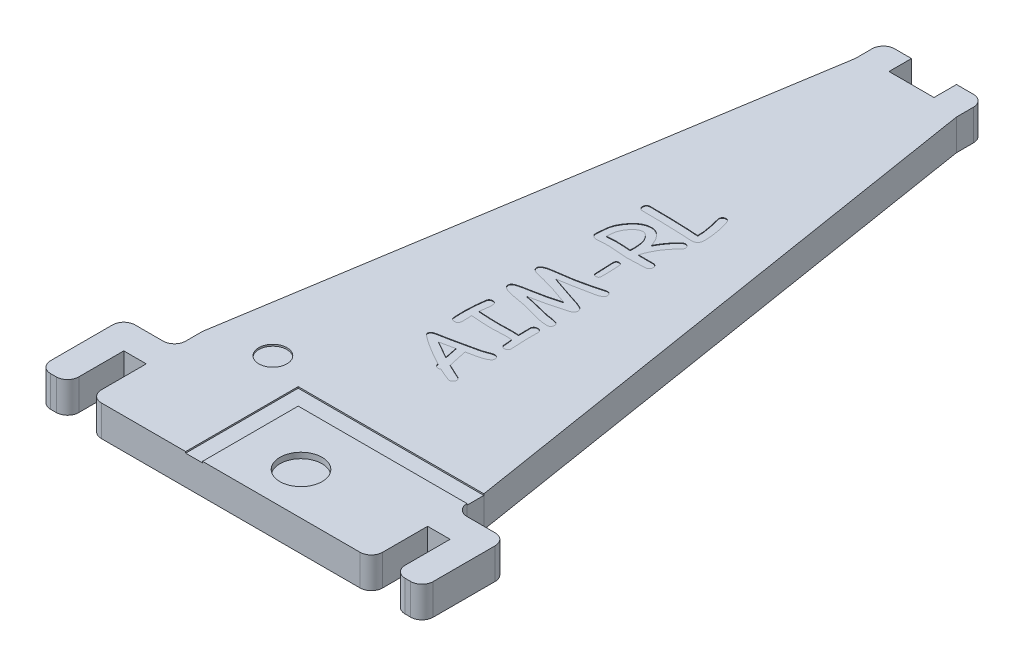
from build123d import *

# Parameters (mm, degrees)
BOSS_EXTRUDE1_DEPTH = 0.55
FILLET1_R           = 0.2
CUT_EXTRUDE1_DEPTH  = 0.025
SKETCH5_R           = 0.25
CUT_EXTRUDE3_DEPTH  = 0.03
SKETCH6_R           = 0.375
CUT_EXTRUDE4_DEPTH  = 0.1
CUT_EXTRUDE5_DEPTH  = 0.01


with BuildPart() as part:
    # Sketch1 → Boss-Extrude1 (new body)
    with BuildSketch(Plane(origin=(0, 0, 0), x_dir=(1, 0, 0), z_dir=(0, 1, 0))):
        Polygon((0, 0), (0, 1.5), (0.9, 1.5), (0.9, 2), (2.5, 12), (2.5, 12.5), (3, 12.5), (3, 12.1), (3.8, 12.1), (3.8, 12.5), (4.3, 12.5), (4.3, 12), (5.9, 2), (5.9, 1.5), (6.8, 1.5), (6.8, 0), (6.3, 0), (6.3, 1), (5.9, 1), (5.9, 0), (0.9, 0), (0.9, 1), (0.5, 1), (0.5, 0), align=None)
    extrude(amount=BOSS_EXTRUDE1_DEPTH)

    # Fillet1
    fillet1_edges = [part.edges().sort_by_distance(p)[0] for p in [
        (0, 0.275, 0),
        (0, 0.275, -1.5),
        (0.9, 0.275, -1.5),
        (2.5, 0.275, -12.5),
        (4.3, 0.275, -12.5),
        (5.9, 0.275, -1.5),
        (6.8, 0.275, -1.5),
        (6.8, 0.275, 0),
        (6.3, 0.275, 0),
        (5.9, 0.275, 0),
        (0.9, 0.275, 0),
        (0.5, 0.275, 0),
    ]]
    fillet(fillet1_edges, radius=FILLET1_R)

    # Sketch3 → Cut-Extrude1 (cut)
    with BuildSketch(Plane(origin=(0, 0.55, 0), x_dir=(1, 0, 0), z_dir=(0, 1, 0))):
        Polygon((5.9, 2), (2.6, 2), (2.6, 0), (2.9, 0), (2.9, 1.7), (5.9, 1.7), align=None)
    extrude(amount=-CUT_EXTRUDE1_DEPTH, mode=Mode.SUBTRACT)

    # Sketch5 → Cut-Extrude3 (cut)
    with BuildSketch(Plane(origin=(0, 0.55, 0), x_dir=(1, 0, 0), z_dir=(0, 1, 0))):
        with Locations(Location((1.9, 2.25, 0), (0, 0, 270))):
            Circle(SKETCH5_R)
    extrude(amount=-CUT_EXTRUDE3_DEPTH, mode=Mode.SUBTRACT)

    # Sketch6 → Cut-Extrude4 (cut)
    with BuildSketch(Plane(origin=(0, 0.55, 0), x_dir=(1, 0, 0), z_dir=(0, 1, 0))):
        with Locations(Location((3.9, 0.75, 0), (0, 0, 270))):
            Circle(SKETCH6_R)
    extrude(amount=-CUT_EXTRUDE4_DEPTH, mode=Mode.SUBTRACT)

    # Sketch7 → Cut-Extrude5 (cut)
    # profile 1 of 6: a face of its own
    with BuildSketch(Plane(origin=(0, 0.55, 0), x_dir=(1, 0, 0), z_dir=(0, 1, 0))):
        with BuildLine():
            add(Edge.make_bspline(
                [(3.875, 8.347239045), (3.877950804, 8.340633179), (3.884153746, 8.326746858), (3.89215336, 8.304064521), (3.900475552, 8.278933799), (3.908119493, 8.250981213), (3.915777784, 8.220449153), (3.923122581, 8.187284146), (3.930389371, 8.151477625), (3.934817651, 8.126675965), (3.937109375, 8.113840608)],
                knots=[0, 0, 0, 0, 0.716894363, 1.506997736, 2.382516578, 3.340795718, 4.37853117, 5.502706371, 6.707600307, 8, 8, 8, 8], degree=3))
            add(Edge.make_bspline(
                [(3.937109375, 8.113840608), (3.939072597, 8.101863318), (3.942900485, 8.078510014), (3.948323535, 8.044367413), (3.952465721, 8.011903096), (3.956363548, 7.981206367), (3.959034786, 7.952081602), (3.960998069, 7.924667845), (3.962254478, 7.898943502), (3.962419922, 7.882396579), (3.9625, 7.874387483)],
                knots=[0, 0, 0, 0, 1.208364037, 2.356066661, 3.441421887, 4.466459362, 5.43647296, 6.352675533, 7.202656582, 8, 8, 8, 8], degree=3))
            add(Edge.make_bspline(
                [(3.9625, 7.874387483), (3.962361623, 7.864077904), (3.962103809, 7.844869779), (3.958097328, 7.818526341), (3.952518917, 7.796297462), (3.94544188, 7.784366246), (3.9421875, 7.77887967)],
                knots=[0, 0, 0, 0, 1.248242448, 2.325642727, 3.230045851, 4, 4, 4, 4], degree=3))
            add(Edge.make_bspline(
                [(3.9421875, 7.77887967), (3.939750342, 7.77572512), (3.934824304, 7.769349072), (3.925430329, 7.761414052), (3.914857574, 7.754451279), (3.902707612, 7.749121729), (3.88939477, 7.744405148), (3.87442099, 7.741799675), (3.858135503, 7.739637011), (3.84675386, 7.739498667), (3.840820312, 7.739426545)],
                knots=[0, 0, 0, 0, 0.844122761, 1.706159937, 2.595573628, 3.52325448, 4.515413457, 5.586101637, 6.741571747, 8, 8, 8, 8], degree=3))
            Line((3.840820312, 7.739426545), (3.623242187, 7.750364045))
            add(Edge.make_bspline(
                [(3.623242187, 7.750364045), (3.597787675, 7.751498935), (3.54623404, 7.753797454), (3.467849956, 7.756765239), (3.387440208, 7.759032552), (3.304952675, 7.7610065), (3.220445901, 7.762539298), (3.133857463, 7.763773539), (3.045248085, 7.764302087), (2.985481809, 7.764384759), (2.955273437, 7.764426545)],
                knots=[0, 0, 0, 0, 0.915198011, 1.853572545, 2.817422793, 3.804526, 4.81724794, 5.853276595, 6.914956373, 8, 8, 8, 8], degree=3))
            add(Edge.make_bspline(
                [(2.955273437, 7.764426545), (2.950688078, 7.764619823), (2.941745523, 7.764996763), (2.928899513, 7.768913198), (2.917233084, 7.775258063), (2.906950691, 7.783874557), (2.898272249, 7.794192242), (2.89199115, 7.806034027), (2.888068854, 7.819065032), (2.887692805, 7.828135426), (2.8875, 7.83278592)],
                knots=[0, 0, 0, 0, 1.024004689, 1.997055877, 2.975332707, 3.979329853, 4.983326999, 5.97444025, 6.961472618, 8, 8, 8, 8], degree=3))
            add(Edge.make_bspline(
                [(2.8875, 7.83278592), (2.887685707, 7.83756773), (2.888045545, 7.84683328), (2.891983046, 7.860022303), (2.898101722, 7.872033734), (2.90669857, 7.8824648), (2.917042446, 7.891090171), (2.928702977, 7.897441163), (2.941550535, 7.901355991), (2.950492876, 7.901733153), (2.955078125, 7.901926545)],
                knots=[0, 0, 0, 0, 1.061271793, 2.056390056, 3.03491476, 4.044172653, 5.042240045, 6.014739028, 6.982043233, 8, 8, 8, 8], degree=3))
            add(Edge.make_bspline(
                [(2.955078125, 7.901926545), (2.985612197, 7.901907971), (3.045965258, 7.901871258), (3.135418867, 7.901008487), (3.222789926, 7.899866912), (3.3080119, 7.898288066), (3.391220441, 7.896411525), (3.472272387, 7.893794765), (3.551317827, 7.890976125), (3.603257338, 7.888500585), (3.62890625, 7.887278108)],
                knots=[0, 0, 0, 0, 1.087178817, 2.148896846, 3.185168921, 4.198336654, 5.183790453, 6.148579661, 7.085726527, 8, 8, 8, 8], degree=3))
            Line((3.62890625, 7.887278108), (3.728710937, 7.880246858))
            add(Edge.make_bspline(
                [(3.728710937, 7.880246858), (3.737496571, 7.879538241), (3.754533819, 7.878164079), (3.77941799, 7.877108122), (3.80273295, 7.876302024), (3.817773356, 7.87672386), (3.825, 7.876926545)],
                knots=[0, 0, 0, 0, 1.0970738, 2.12746397, 3.100280121, 4, 4, 4, 4], degree=3))
            add(Edge.make_bspline(
                [(3.825, 7.876926545), (3.824870291, 7.891513656), (3.824601938, 7.921692829), (3.821586055, 7.968370435), (3.816005834, 8.017809103), (3.808130963, 8.069981523), (3.797973356, 8.124975759), (3.785098234, 8.182678344), (3.770388099, 8.243378122), (3.758853379, 8.284512694), (3.752929688, 8.305637483)],
                knots=[0, 0, 0, 0, 0.802635763, 1.660567672, 2.572505645, 3.539741198, 4.563550896, 5.649275195, 6.792777905, 8, 8, 8, 8], degree=3))
            add(Edge.make_bspline(
                [(3.752929688, 8.305637483), (3.752100935, 8.309202592), (3.750516313, 8.316019288), (3.750166745, 8.323007302), (3.75, 8.326340608)],
                knots=[0, 0, 0, 0, 1.045993323, 2, 2, 2, 2], degree=3))
            add(Edge.make_bspline(
                [(3.75, 8.326340608), (3.750261515, 8.330863891), (3.750772267, 8.339698117), (3.754844711, 8.352330817), (3.761596937, 8.363827619), (3.76800099, 8.370030714), (3.771289062, 8.373215608)],
                knots=[0, 0, 0, 0, 1.020445198, 1.992986761, 2.969526912, 4, 4, 4, 4], degree=3))
            add(Edge.make_bspline(
                [(3.771289062, 8.373215608), (3.774598459, 8.37568254), (3.781091162, 8.380522413), (3.792092898, 8.385623556), (3.803776077, 8.388951063), (3.811890804, 8.389266304), (3.816015625, 8.389426545)],
                knots=[0, 0, 0, 0, 1.018403838, 1.998005638, 2.982360251, 4, 4, 4, 4], degree=3))
            add(Edge.make_bspline(
                [(3.816015625, 8.389426545), (3.819281852, 8.38933851), (3.825617672, 8.38916774), (3.83478501, 8.38712842), (3.843303113, 8.383788133), (3.851115195, 8.3790521), (3.858301755, 8.373125524), (3.8645621, 8.365711516), (3.870282433, 8.35706072), (3.873384702, 8.350601993), (3.875, 8.347239045)],
                knots=[0, 0, 0, 0, 1.012499008, 1.964043618, 2.898691715, 3.84160927, 4.788850173, 5.777666492, 6.842869086, 8, 8, 8, 8], degree=3))
        make_face()
    # profile 2 of 6: a face of its own
    with BuildSketch(Plane(origin=(0, 0.55, 0), x_dir=(1, 0, 0), z_dir=(0, 1, 0))):
        with BuildLine():
            add(Edge.make_bspline(
                [(3.9125, 7.57341092), (3.912212726, 7.569410495), (3.911629545, 7.561289423), (3.907544211, 7.549394913), (3.900660896, 7.53797405), (3.894469705, 7.531248058), (3.891210937, 7.527707795)],
                knots=[0, 0, 0, 0, 0.92759402, 1.883064472, 2.885739552, 4, 4, 4, 4], degree=3))
            add(Edge.make_bspline(
                [(3.891210937, 7.527707795), (3.873557926, 7.509801852), (3.838693519, 7.474437909), (3.790580491, 7.418680476), (3.747107044, 7.361268757), (3.707969091, 7.302471225), (3.673229273, 7.242163438), (3.643132805, 7.180285398), (3.617258219, 7.116980534), (3.603791203, 7.073584103), (3.597070312, 7.051926545)],
                knots=[0, 0, 0, 0, 1.06668371, 2.106682745, 3.122149944, 4.120443899, 5.101746213, 6.072804342, 7.03820772, 8, 8, 8, 8], degree=3))
            Line((3.597070312, 7.051926545), (3.7265625, 7.051926545))
            Line((3.7265625, 7.051926545), (3.856835937, 7.051926545))
            add(Edge.make_bspline(
                [(3.856835937, 7.051926545), (3.861482868, 7.051723036), (3.870608949, 7.051323367), (3.883692313, 7.047528469), (3.895463882, 7.041089181), (3.90573045, 7.032472626), (3.914457905, 7.022213397), (3.920507056, 7.010209641), (3.924438496, 6.997093717), (3.924809698, 6.987893272), (3.925, 6.983176545)],
                knots=[0, 0, 0, 0, 1.030253241, 2.023308341, 2.993791058, 3.989789173, 4.985787287, 5.962283232, 6.955338332, 8, 8, 8, 8], degree=3))
            add(Edge.make_bspline(
                [(3.925, 6.983176545), (3.924808832, 6.978460493), (3.924435939, 6.969261364), (3.920516628, 6.956135992), (3.914399372, 6.944122344), (3.905797256, 6.933699454), (3.895540752, 6.925101039), (3.88379284, 6.918818652), (3.870806704, 6.915024714), (3.861679005, 6.914628364), (3.85703125, 6.914426545)],
                knots=[0, 0, 0, 0, 1.04576213, 2.039863328, 3.017387927, 4.025614305, 5.022661618, 5.974560277, 6.968661475, 8, 8, 8, 8], degree=3))
            add(Edge.make_bspline(
                [(3.85703125, 6.914426545), (3.85240841, 6.914458477), (3.842640197, 6.91452595), (3.82721529, 6.913956745), (3.810148929, 6.913745298), (3.791539983, 6.912771897), (3.771279025, 6.912172093), (3.749419861, 6.910796231), (3.725898632, 6.90983995), (3.701376836, 6.90807334), (3.676882038, 6.906918806), (3.653461815, 6.905350741), (3.631635715, 6.904574657), (3.61140251, 6.903384063), (3.592770473, 6.90299715), (3.57572169, 6.902216859), (3.560285739, 6.902156637), (3.550520634, 6.902000466), (3.545898438, 6.901926545)],
                knots=[0, 0, 0, 0, 0.712445335, 1.505420197, 2.37864724, 3.34278945, 4.377115989, 5.502584942, 6.718244155, 8.005158812, 9.291486525, 10.497666444, 11.622643233, 12.657407746, 13.621184365, 14.49469963, 15.287484003, 16, 16, 16, 16], degree=3))
            add(Edge.make_bspline(
                [(3.545898438, 6.901926545), (3.54049435, 6.901968343), (3.529097441, 6.902056492), (3.511126193, 6.902686176), (3.491333227, 6.903673803), (3.469652778, 6.905056567), (3.446083614, 6.906812678), (3.420628874, 6.908985068), (3.393347798, 6.911508141), (3.364843937, 6.914428574), (3.336403464, 6.917330502), (3.309190037, 6.919881108), (3.283863422, 6.922029276), (3.260425448, 6.923796228), (3.238875514, 6.925186235), (3.219212123, 6.926160844), (3.201371387, 6.9267971), (3.190104624, 6.926884927), (3.184765625, 6.926926545)],
                knots=[0, 0, 0, 0, 0.71629614, 1.510627306, 2.383268869, 3.343040369, 4.390087922, 5.51592497, 6.729244953, 8.021531754, 9.313818555, 10.51854632, 11.644383367, 12.682825442, 13.633984758, 14.506626321, 15.292332674, 16, 16, 16, 16], degree=3))
            add(Edge.make_bspline(
                [(3.184765625, 6.926926545), (3.178449215, 6.9268367), (3.164505653, 6.926638367), (3.141585627, 6.9253406), (3.114629159, 6.923390228), (3.084960938, 6.920676545), (3.055292716, 6.917962862), (3.028336248, 6.91601249), (3.005416222, 6.914714723), (2.99147266, 6.91451639), (2.98515625, 6.914426545)],
                knots=[0, 0, 0, 0, 0.757749544, 1.672742668, 2.753375099, 4, 5.246624901, 6.327257332, 7.242250456, 8, 8, 8, 8], degree=3))
            add(Edge.make_bspline(
                [(2.98515625, 6.914426545), (2.979077981, 6.91468889), (2.967181734, 6.915202346), (2.94990286, 6.919268552), (2.93361093, 6.925821828), (2.923984167, 6.932403933), (2.919140625, 6.935715608)],
                knots=[0, 0, 0, 0, 1.032840748, 2.021452059, 3.004527328, 4, 4, 4, 4], degree=3))
            add(Edge.make_bspline(
                [(2.919140625, 6.935715608), (2.913846186, 6.940075689), (2.903531038, 6.948570431), (2.892969508, 6.965625011), (2.88716155, 6.985012527), (2.88738395, 6.998565452), (2.8875, 7.005637483)],
                knots=[0, 0, 0, 0, 1.01891203, 1.985145153, 2.948631896, 4, 4, 4, 4], degree=3))
            Line((2.8875, 7.005637483), (2.9, 7.165989045))
            add(Edge.make_bspline(
                [(2.9, 7.165989045), (2.902106421, 7.180616322), (2.906190011, 7.208973324), (2.91598702, 7.249355216), (2.92828139, 7.286369801), (2.939215137, 7.308927488), (2.94453125, 7.319895295)],
                knots=[0, 0, 0, 0, 1.100642549, 2.133747954, 3.092606825, 4, 4, 4, 4], degree=3))
            add(Edge.make_bspline(
                [(2.94453125, 7.319895295), (2.950420115, 7.33082482), (2.961950305, 7.35222444), (2.980615467, 7.382737328), (2.999685962, 7.411230498), (3.019220972, 7.437643052), (3.039141747, 7.461977191), (3.059654304, 7.484129504), (3.080824654, 7.504048076), (3.102264068, 7.522095371), (3.124218657, 7.53802515), (3.146731653, 7.55178991), (3.169864072, 7.563247127), (3.193328519, 7.573033689), (3.217471549, 7.580148998), (3.242011426, 7.585439875), (3.267020138, 7.588969964), (3.283907477, 7.589273971), (3.292382813, 7.589426545)],
                knots=[0, 0, 0, 0, 1.285088098, 2.516156837, 3.70133193, 4.833679489, 5.915871266, 6.955543635, 7.956797627, 8.923330369, 9.854944987, 10.762351267, 11.651551949, 12.525187581, 13.390909519, 14.252845023, 15.123146355, 16, 16, 16, 16], degree=3))
            add(Edge.make_bspline(
                [(3.292382813, 7.589426545), (3.300670655, 7.589185558), (3.317100333, 7.58870783), (3.34136602, 7.584199611), (3.364929806, 7.576998304), (3.38767511, 7.566684138), (3.40973672, 7.553732415), (3.430889823, 7.537671441), (3.451533296, 7.518937069), (3.464071429, 7.504599275), (3.470507812, 7.497239045)],
                knots=[0, 0, 0, 0, 0.957970178, 1.899063634, 2.844846954, 3.802284053, 4.781397299, 5.798168747, 6.869701761, 8, 8, 8, 8], degree=3))
            add(Edge.make_bspline(
                [(3.470507812, 7.497239045), (3.475594692, 7.490914832), (3.485867695, 7.478143023), (3.500019373, 7.457817309), (3.513450327, 7.436442888), (3.525620892, 7.413798609), (3.537093686, 7.390063423), (3.547263869, 7.365059886), (3.557003381, 7.339074623), (3.562465013, 7.321164339), (3.565234375, 7.312082795)],
                knots=[0, 0, 0, 0, 0.929713851, 1.877566122, 2.835927701, 3.820636964, 4.821600353, 5.855058901, 6.912391442, 8, 8, 8, 8], degree=3))
            add(Edge.make_bspline(
                [(3.565234375, 7.312082795), (3.574435315, 7.328875928), (3.592392337, 7.361650261), (3.620557502, 7.408694511), (3.64925649, 7.452347803), (3.678083739, 7.492991262), (3.707609676, 7.530050397), (3.737289848, 7.563977903), (3.76734425, 7.594664672), (3.788360096, 7.61305459), (3.798632812, 7.622043733)],
                knots=[0, 0, 0, 0, 1.177489967, 2.298049355, 3.370731458, 4.389520182, 5.361182849, 6.283175119, 7.160802, 8, 8, 8, 8], degree=3))
            add(Edge.make_bspline(
                [(3.798632812, 7.622043733), (3.802133917, 7.624705121), (3.80893267, 7.62987324), (3.820170381, 7.635396505), (3.831784836, 7.63866397), (3.839628521, 7.639172167), (3.843554688, 7.639426545)],
                knots=[0, 0, 0, 0, 1.072795615, 2.083249237, 3.040567974, 4, 4, 4, 4], degree=3))
            add(Edge.make_bspline(
                [(3.843554688, 7.639426545), (3.848071078, 7.639218634), (3.857003412, 7.638807435), (3.869889351, 7.635000101), (3.881637988, 7.628484074), (3.892269843, 7.620015259), (3.90113582, 7.609813638), (3.907818055, 7.598543462), (3.911662081, 7.586217091), (3.912217171, 7.577733475), (3.9125, 7.57341092)],
                knots=[0, 0, 0, 0, 1.024492477, 2.02620001, 3.019021827, 4.06087982, 5.098950756, 6.073196883, 7.018259131, 8, 8, 8, 8], degree=3))
        make_face()
        with BuildLine():
            Line((3.033007812, 7.148996858), (3.025, 7.051926545))
            Line((3.025, 7.051926545), (3.105078125, 7.05934842))
            add(Edge.make_bspline(
                [(3.105078125, 7.05934842), (3.112890557, 7.06005967), (3.127729093, 7.061410582), (3.148862699, 7.063409967), (3.167769998, 7.064050644), (3.179622453, 7.064306901), (3.18515625, 7.064426545)],
                knots=[0, 0, 0, 0, 1.172826967, 2.227607707, 3.172487062, 4, 4, 4, 4], degree=3))
            add(Edge.make_bspline(
                [(3.18515625, 7.064426545), (3.194532295, 7.06441668), (3.214331001, 7.06439585), (3.245641045, 7.063193494), (3.280225816, 7.06199519), (3.304364726, 7.060513921), (3.316992187, 7.059739045)],
                knots=[0, 0, 0, 0, 0.852682441, 1.800547017, 2.849429868, 4, 4, 4, 4], degree=3))
            Line((3.316992187, 7.059739045), (3.448632812, 7.051926545))
            add(Edge.make_bspline(
                [(3.448632812, 7.051926545), (3.448695722, 7.055767703), (3.448847144, 7.065013318), (3.4491489, 7.079730052), (3.449847089, 7.094565231), (3.44995473, 7.104009348), (3.45, 7.107981233)],
                knots=[0, 0, 0, 0, 0.822147572, 1.978897641, 3.149990892, 4, 4, 4, 4], degree=3))
            add(Edge.make_bspline(
                [(3.45, 7.107981233), (3.449821962, 7.121133968), (3.449478025, 7.146542767), (3.447637819, 7.183441328), (3.444086381, 7.217780108), (3.439392023, 7.249646488), (3.432847014, 7.278827652), (3.425326913, 7.305580513), (3.416349851, 7.329857582), (3.408735204, 7.34463439), (3.405078125, 7.351731233)],
                knots=[0, 0, 0, 0, 1.261397645, 2.436800874, 3.541356735, 4.570917686, 5.52371442, 6.407028209, 7.234945022, 8, 8, 8, 8], degree=3))
            add(Edge.make_bspline(
                [(3.405078125, 7.351731233), (3.40146306, 7.357655078), (3.394162738, 7.369617792), (3.381361842, 7.386498793), (3.367274701, 7.402953765), (3.35673204, 7.413016733), (3.351367188, 7.418137483)],
                knots=[0, 0, 0, 0, 0.970995645, 1.960844865, 2.962333636, 4, 4, 4, 4], degree=3))
            add(Edge.make_bspline(
                [(3.351367188, 7.418137483), (3.345565731, 7.423248327), (3.334877955, 7.432663816), (3.318379254, 7.443381579), (3.303129009, 7.45035759), (3.293088937, 7.451432661), (3.288476563, 7.451926545)],
                knots=[0, 0, 0, 0, 1.272584969, 2.34442902, 3.239436328, 4, 4, 4, 4], degree=3))
            add(Edge.make_bspline(
                [(3.288476563, 7.451926545), (3.280833032, 7.451644278), (3.265582741, 7.451081103), (3.242951839, 7.445910829), (3.220864488, 7.437568392), (3.198888058, 7.426394967), (3.177651969, 7.41155936), (3.156823161, 7.393531575), (3.136287474, 7.372429928), (3.12356767, 7.356596161), (3.116992187, 7.34841092)],
                knots=[0, 0, 0, 0, 0.88245348, 1.760661896, 2.667794414, 3.606733471, 4.602337306, 5.653571864, 6.787017713, 8, 8, 8, 8], degree=3))
            add(Edge.make_bspline(
                [(3.116992187, 7.34841092), (3.111173493, 7.340531789), (3.099667578, 7.324951554), (3.084179024, 7.300767056), (3.070969099, 7.276045279), (3.059349214, 7.251257401), (3.049705326, 7.226140276), (3.042124023, 7.200735193), (3.036297229, 7.175031742), (3.034104771, 7.157679003), (3.033007812, 7.148996858)],
                knots=[0, 0, 0, 0, 1.072583951, 2.120933036, 3.141837587, 4.140335143, 5.117603438, 6.085357071, 7.042041242, 8, 8, 8, 8], degree=3))
        make_face(mode=Mode.SUBTRACT)
    # profile 3 of 6: a face of its own
    with BuildSketch(Plane(origin=(0, 0.55, 0), x_dir=(1, 0, 0), z_dir=(0, 1, 0))):
        with BuildLine():
            add(Edge.make_bspline(
                [(3.590820312, 6.71247342), (3.591568651, 6.704338046), (3.593201622, 6.686585594), (3.595103847, 6.657738109), (3.596638329, 6.624528509), (3.597736937, 6.586956285), (3.598699833, 6.545028299), (3.599525217, 6.498739345), (3.599839566, 6.448150896), (3.599945089, 6.412994252), (3.6, 6.394699983)],
                knots=[0, 0, 0, 0, 0.616547238, 1.345386988, 2.18158764, 3.125419028, 4.182083489, 5.346722747, 6.619328683, 8, 8, 8, 8], degree=3))
            add(Edge.make_bspline(
                [(3.6, 6.394699983), (3.599863609, 6.390392795), (3.599605044, 6.382227417), (3.59734729, 6.370832031), (3.593379897, 6.361124678), (3.587864086, 6.353090827), (3.580599882, 6.346822058), (3.571696231, 6.34255821), (3.561373944, 6.339688001), (3.553928091, 6.339516841), (3.55, 6.339426545)],
                knots=[0, 0, 0, 0, 1.210837535, 2.295452496, 3.247698464, 4.141824876, 5.011809503, 5.912661574, 6.898815703, 8, 8, 8, 8], degree=3))
            add(Edge.make_bspline(
                [(3.55, 6.339426545), (3.546071909, 6.339516841), (3.538626056, 6.339688001), (3.528303769, 6.34255821), (3.519400118, 6.346822058), (3.512135914, 6.353090827), (3.506620103, 6.361124678), (3.50265271, 6.370832031), (3.500394956, 6.382227417), (3.500136391, 6.390392795), (3.5, 6.394699983)],
                knots=[0, 0, 0, 0, 1.101184297, 2.087338426, 2.988190497, 3.858175124, 4.752301536, 5.704547504, 6.789162465, 8, 8, 8, 8], degree=3))
            add(Edge.make_bspline(
                [(3.5, 6.394699983), (3.500031261, 6.399257709), (3.500097814, 6.408960805), (3.499529957, 6.424320627), (3.49931878, 6.441386989), (3.498345551, 6.459995949), (3.497744628, 6.480256846), (3.496377674, 6.502051364), (3.495399062, 6.52557137), (3.493647139, 6.550159162), (3.492499083, 6.574784448), (3.490917724, 6.598334225), (3.490147764, 6.620290799), (3.48896762, 6.640589556), (3.488565161, 6.659220996), (3.487790884, 6.676204876), (3.487729971, 6.691640802), (3.487573883, 6.70140591), (3.4875, 6.706028108)],
                knots=[0, 0, 0, 0, 0.701972338, 1.494452099, 2.367133936, 3.330674175, 4.364354924, 5.489121181, 6.694005619, 7.990125579, 9.285663492, 10.491090323, 11.625383009, 12.669517954, 13.622669598, 14.495639477, 15.287928868, 16, 16, 16, 16], degree=3))
            add(Edge.make_bspline(
                [(3.4875, 6.706028108), (3.487605402, 6.710602365), (3.487804565, 6.719245639), (3.490433022, 6.731205991), (3.49421595, 6.741560005), (3.500047926, 6.749946258), (3.507444705, 6.756701089), (3.516706505, 6.761091744), (3.527371195, 6.763938972), (3.535004848, 6.764257325), (3.5390625, 6.764426545)],
                knots=[0, 0, 0, 0, 1.229179724, 2.322592769, 3.282971312, 4.177745226, 5.046906543, 5.948523952, 6.909542321, 8, 8, 8, 8], degree=3))
            add(Edge.make_bspline(
                [(3.5390625, 6.764426545), (3.542664611, 6.764317313), (3.54957815, 6.764107663), (3.559247254, 6.761384697), (3.567920339, 6.757605882), (3.575162275, 6.751670744), (3.581034621, 6.744081369), (3.585768771, 6.734966888), (3.589044651, 6.724233991), (3.590207819, 6.716530094), (3.590820312, 6.71247342)],
                knots=[0, 0, 0, 0, 1.051958694, 2.019026751, 2.923686369, 3.805532346, 4.729101205, 5.718856889, 6.798808991, 8, 8, 8, 8], degree=3))
        make_face()
    # profile 4 of 6: a face of its own
    with BuildSketch(Plane(origin=(0, 0.55, 0), x_dir=(1, 0, 0), z_dir=(0, 1, 0))):
        with BuildLine():
            add(Edge.make_bspline(
                [(3.95, 6.145676545), (3.949632475, 6.139999724), (3.948908143, 6.128811617), (3.941592663, 6.113099502), (3.930152993, 6.099093696), (3.919996854, 6.091865738), (3.914648438, 6.088059358)],
                knots=[0, 0, 0, 0, 0.959160072, 1.890351017, 2.889018652, 4, 4, 4, 4], degree=3))
            add(Edge.make_bspline(
                [(3.914648438, 6.088059358), (3.908857998, 6.084789343), (3.895930677, 6.077488943), (3.872860351, 6.069006513), (3.845070422, 6.060295414), (3.824651712, 6.055615155), (3.813671875, 6.05309842)],
                knots=[0, 0, 0, 0, 0.742751013, 1.658213032, 2.74074123, 4, 4, 4, 4], degree=3))
            Line((3.813671875, 6.05309842), (3.700390625, 6.029856233))
            add(Edge.make_bspline(
                [(3.700390625, 6.029856233), (3.695645993, 6.028649927), (3.685603557, 6.026096674), (3.669373262, 6.022753714), (3.651360883, 6.018450716), (3.631111563, 6.014529978), (3.609025858, 6.009917752), (3.584826783, 6.00552646), (3.558718509, 6.000654872), (3.530638379, 5.995263627), (3.500509254, 5.99014246), (3.468505084, 5.984390572), (3.434455727, 5.97852674), (3.398363268, 5.972553747), (3.360300074, 5.966038103), (3.32025643, 5.959423522), (3.278265561, 5.952578505), (3.249610798, 5.948011463), (3.234960938, 5.945676545)],
                knots=[0, 0, 0, 0, 0.496658207, 1.051221438, 1.68101768, 2.375400972, 3.143623008, 3.970205625, 4.870641242, 5.838436678, 6.871229342, 7.971369117, 9.137717576, 10.376808206, 11.683232474, 13.055897193, 14.494815811, 16, 16, 16, 16], degree=3))
            Line((3.234960938, 5.945676545), (3.632421875, 5.81169217))
            Line((3.632421875, 5.81169217), (3.757617188, 5.772043733))
            add(Edge.make_bspline(
                [(3.757617188, 5.772043733), (3.769504499, 5.768114679), (3.792333604, 5.76056909), (3.824490883, 5.74803332), (3.853379173, 5.735477884), (3.87107526, 5.726241563), (3.879492188, 5.72184842)],
                knots=[0, 0, 0, 0, 1.138079952, 2.185636811, 3.137020328, 4, 4, 4, 4], degree=3))
            add(Edge.make_bspline(
                [(3.879492188, 5.72184842), (3.883146888, 5.719539294), (3.890240306, 5.715057504), (3.899354094, 5.706888386), (3.907385929, 5.698463126), (3.913864395, 5.689264346), (3.918784691, 5.679358724), (3.922316036, 5.668913911), (3.924530865, 5.657877828), (3.92484178, 5.650309311), (3.925, 5.646457795)],
                knots=[0, 0, 0, 0, 1.12138879, 2.176506675, 3.170017907, 4.141537379, 5.087232601, 6.03413754, 6.999599269, 8, 8, 8, 8], degree=3))
            add(Edge.make_bspline(
                [(3.925, 5.646457795), (3.924579122, 5.640197285), (3.923752512, 5.627901541), (3.916224372, 5.610695396), (3.904083907, 5.595674558), (3.893204201, 5.588372291), (3.8875, 5.584543733)],
                knots=[0, 0, 0, 0, 0.986319395, 1.937147192, 2.918451782, 4, 4, 4, 4], degree=3))
            add(Edge.make_bspline(
                [(3.8875, 5.584543733), (3.882590446, 5.582048792), (3.872363622, 5.576851716), (3.855490724, 5.570439216), (3.837057477, 5.563593142), (3.823860021, 5.559902045), (3.816992188, 5.557981233)],
                knots=[0, 0, 0, 0, 0.874902059, 1.822461019, 2.866828981, 4, 4, 4, 4], degree=3))
            Line((3.816992188, 5.557981233), (3.74375, 5.538840608))
            add(Edge.make_bspline(
                [(3.74375, 5.538840608), (3.704344406, 5.5278556), (3.624402289, 5.50557032), (3.501847589, 5.474994335), (3.375173019, 5.446460563), (3.289101279, 5.429345137), (3.245507813, 5.420676545)],
                knots=[0, 0, 0, 0, 0.958328754, 1.944161251, 2.958762347, 4, 4, 4, 4], degree=3))
            Line((3.245507813, 5.420676545), (3.3625, 5.397434358))
            Line((3.3625, 5.397434358), (3.7078125, 5.314426545))
            add(Edge.make_bspline(
                [(3.7078125, 5.314426545), (3.713155394, 5.313944744), (3.724514966, 5.312920383), (3.742402734, 5.310461046), (3.762212155, 5.307570081), (3.78377044, 5.303870533), (3.807112056, 5.299270627), (3.832247855, 5.294218615), (3.859286168, 5.288575157), (3.877870579, 5.284375839), (3.8875, 5.282199983)],
                knots=[0, 0, 0, 0, 0.704682276, 1.498230933, 2.371566791, 3.334766419, 4.371419229, 5.496953596, 6.703058906, 8, 8, 8, 8], degree=3))
            add(Edge.make_bspline(
                [(3.8875, 5.282199983), (3.89145485, 5.280539769), (3.899048625, 5.277351963), (3.909210645, 5.271206422), (3.918065906, 5.264590017), (3.925147337, 5.256873055), (3.930730112, 5.248372085), (3.934664523, 5.239043725), (3.937085242, 5.228936993), (3.937359408, 5.221927334), (3.9375, 5.218332795)],
                knots=[0, 0, 0, 0, 1.182980922, 2.271462135, 3.271240398, 4.225523803, 5.148115151, 6.066492127, 7.00850128, 8, 8, 8, 8], degree=3))
            add(Edge.make_bspline(
                [(3.9375, 5.218332795), (3.937287467, 5.213279731), (3.936878475, 5.203555748), (3.932304713, 5.18991288), (3.925229175, 5.177695141), (3.918351536, 5.171365681), (3.91484375, 5.168137483)],
                knots=[0, 0, 0, 0, 1.060616523, 2.041022336, 3.000867405, 4, 4, 4, 4], degree=3))
            add(Edge.make_bspline(
                [(3.91484375, 5.168137483), (3.911545852, 5.165646782), (3.904885958, 5.160616972), (3.893162329, 5.155715642), (3.880460362, 5.152367841), (3.871573154, 5.152076644), (3.866992188, 5.151926545)],
                knots=[0, 0, 0, 0, 0.958743918, 1.936122096, 2.936161401, 4, 4, 4, 4], degree=3))
            add(Edge.make_bspline(
                [(3.866992188, 5.151926545), (3.857745151, 5.152119832), (3.838712317, 5.152517669), (3.809436706, 5.154444808), (3.778639436, 5.158100619), (3.746323258, 5.162945067), (3.712407713, 5.169302925), (3.676938501, 5.176822041), (3.640010348, 5.186141096), (3.614962721, 5.19296613), (3.602148438, 5.196457795)],
                knots=[0, 0, 0, 0, 0.824042072, 1.69609536, 2.612788883, 3.586582681, 4.607146524, 5.686861406, 6.816605879, 8, 8, 8, 8], degree=3))
            Line((3.602148438, 5.196457795), (3.336328125, 5.267356233))
            Line((3.336328125, 5.267356233), (3.128710938, 5.30466092))
            add(Edge.make_bspline(
                [(3.128710938, 5.30466092), (3.117109514, 5.307009817), (3.094827738, 5.311521126), (3.063123077, 5.318931746), (3.034527662, 5.326340605), (3.009083289, 5.333693753), (2.986790161, 5.341168261), (2.967762848, 5.34910221), (2.951641107, 5.356597719), (2.942462198, 5.362513284), (2.93828125, 5.365207795)],
                knots=[0, 0, 0, 0, 1.414207589, 2.716137283, 3.889666348, 4.943215356, 5.880445309, 6.696617245, 7.406315533, 8, 8, 8, 8], degree=3))
            add(Edge.make_bspline(
                [(2.93828125, 5.365207795), (2.932438458, 5.369574182), (2.921366458, 5.377848416), (2.909179953, 5.393767971), (2.90123136, 5.411127411), (2.900412108, 5.423458183), (2.9, 5.42966092)],
                knots=[0, 0, 0, 0, 1.116006581, 2.11481503, 3.051697038, 4, 4, 4, 4], degree=3))
            add(Edge.make_bspline(
                [(2.9, 5.42966092), (2.9001363, 5.433127232), (2.900401968, 5.439883593), (2.902874526, 5.449560729), (2.906636457, 5.45865356), (2.912092623, 5.466973253), (2.919206067, 5.474546), (2.927570949, 5.481534098), (2.937497633, 5.487942389), (2.944933131, 5.491223435), (2.948828125, 5.49294217)],
                knots=[0, 0, 0, 0, 0.974860151, 1.90014827, 2.796066372, 3.737215669, 4.684777108, 5.713369759, 6.802177105, 8, 8, 8, 8], degree=3))
            add(Edge.make_bspline(
                [(2.948828125, 5.49294217), (2.954334576, 5.495228654), (2.966422259, 5.50024791), (2.986893241, 5.506749337), (3.011137726, 5.513220505), (3.0390813, 5.520365701), (3.070949498, 5.527312625), (3.106662513, 5.53425075), (3.146116044, 5.541491917), (3.173691956, 5.546166309), (3.188085938, 5.548606233)],
                knots=[0, 0, 0, 0, 0.581236301, 1.275921689, 2.09225498, 3.028489211, 4.088314635, 5.272448532, 6.576281799, 8, 8, 8, 8], degree=3))
            add(Edge.make_bspline(
                [(3.188085938, 5.548606233), (3.206330593, 5.551645274), (3.243279478, 5.557799909), (3.299083851, 5.568749189), (3.35617345, 5.580340624), (3.414325515, 5.593422183), (3.473506623, 5.608030285), (3.533926569, 5.623344167), (3.595370368, 5.640163057), (3.636603953, 5.652133124), (3.657421875, 5.658176545)],
                knots=[0, 0, 0, 0, 0.920409794, 1.864004282, 2.829825251, 3.819421933, 4.829969225, 5.863304241, 6.92122972, 8, 8, 8, 8], degree=3))
            add(Edge.make_bspline(
                [(3.657421875, 5.658176545), (3.614804653, 5.674377327), (3.529095715, 5.706959269), (3.398155897, 5.75152157), (3.264587147, 5.79288595), (3.174164044, 5.817488989), (3.128710938, 5.829856233)],
                knots=[0, 0, 0, 0, 0.983642058, 1.97823584, 2.98371701, 4, 4, 4, 4], degree=3))
            Line((3.128710938, 5.829856233), (3.032421875, 5.84997342))
            add(Edge.make_bspline(
                [(3.032421875, 5.84997342), (3.023208549, 5.85199467), (3.005561094, 5.855866226), (2.980774815, 5.863428784), (2.958479657, 5.87127091), (2.945184141, 5.878150234), (2.938867188, 5.881418733)],
                knots=[0, 0, 0, 0, 1.142374087, 2.188134223, 3.139147904, 4, 4, 4, 4], degree=3))
            add(Edge.make_bspline(
                [(2.938867188, 5.881418733), (2.934763767, 5.883522572), (2.926875846, 5.887566739), (2.916565094, 5.895157037), (2.907512427, 5.902939197), (2.90033317, 5.911594803), (2.894455981, 5.920715493), (2.890365444, 5.930491945), (2.887915982, 5.940934214), (2.887640984, 5.948071914), (2.8875, 5.951731233)],
                knots=[0, 0, 0, 0, 1.199142974, 2.305088297, 3.326121748, 4.301047848, 5.223219202, 6.142892288, 7.047907664, 8, 8, 8, 8], degree=3))
            add(Edge.make_bspline(
                [(2.8875, 5.951731233), (2.887837602, 5.956339183), (2.888516313, 5.965602942), (2.894177335, 5.978873473), (2.903399741, 5.991002603), (2.915815117, 6.002349348), (2.931940624, 6.012482988), (2.951249879, 6.021955075), (2.974168117, 6.030550747), (2.990779075, 6.035198181), (2.999609375, 6.037668733)],
                knots=[0, 0, 0, 0, 0.729409433, 1.466394321, 2.249816595, 3.134838351, 4.120957129, 5.262595651, 6.544809998, 8, 8, 8, 8], degree=3))
            add(Edge.make_bspline(
                [(2.999609375, 6.037668733), (3.003115679, 6.038619829), (3.010985666, 6.040754589), (3.02420402, 6.043288545), (3.039884361, 6.046262847), (3.058038632, 6.049407761), (3.078765916, 6.05245277), (3.101943996, 6.055767076), (3.127656987, 6.059310234), (3.145636258, 6.061640368), (3.155078125, 6.062864045)],
                knots=[0, 0, 0, 0, 0.553116127, 1.241483132, 2.04851274, 2.984162884, 4.047067603, 5.238941889, 6.55002235, 8, 8, 8, 8], degree=3))
            add(Edge.make_bspline(
                [(3.155078125, 6.062864045), (3.179498487, 6.066137387), (3.227398949, 6.072558036), (3.297883177, 6.08281919), (3.365554827, 6.094084323), (3.430601846, 6.105383751), (3.492785523, 6.117892659), (3.552370874, 6.130388776), (3.609180828, 6.143913433), (3.646044054, 6.153493759), (3.6640625, 6.158176545)],
                knots=[0, 0, 0, 0, 1.141109416, 2.238282413, 3.298579252, 4.318279249, 5.295748833, 6.236037415, 7.137789403, 8, 8, 8, 8], degree=3))
            Line((3.6640625, 6.158176545), (3.77734375, 6.18981717))
            add(Edge.make_bspline(
                [(3.77734375, 6.18981717), (3.784300335, 6.191805489), (3.797467037, 6.195568772), (3.816336894, 6.200382504), (3.833047346, 6.20469442), (3.847660309, 6.208321133), (3.860212468, 6.210767977), (3.870537975, 6.212788045), (3.878808455, 6.214104279), (3.883655752, 6.214329572), (3.885742188, 6.214426545)],
                knots=[0, 0, 0, 0, 1.559778982, 2.952187862, 4.198165584, 5.280768401, 6.197425036, 6.954465388, 7.549967658, 8, 8, 8, 8], degree=3))
            add(Edge.make_bspline(
                [(3.885742188, 6.214426545), (3.890131051, 6.214154347), (3.89876423, 6.213618915), (3.91114574, 6.209652202), (3.922157411, 6.202690382), (3.931767296, 6.193504737), (3.939883098, 6.182861272), (3.945624596, 6.17101772), (3.949349575, 6.15859646), (3.949782369, 6.149999517), (3.95, 6.145676545)],
                knots=[0, 0, 0, 0, 1.01047925, 1.987677862, 2.95759635, 3.986937889, 5.036947306, 6.023084944, 7.005908593, 8, 8, 8, 8], degree=3))
        make_face()
    # profile 5 of 6: a face of its own
    with BuildSketch(Plane(origin=(0, 0.55, 0), x_dir=(1, 0, 0), z_dir=(0, 1, 0))):
        with BuildLine():
            add(Edge.make_bspline(
                [(3.072460938, 4.982981233), (3.072319115, 4.975362164), (3.072018257, 4.959199259), (3.07039501, 4.933593423), (3.067596704, 4.905273784), (3.065148932, 4.885515112), (3.063867188, 4.875168733)],
                knots=[0, 0, 0, 0, 0.844908799, 1.792368763, 2.844001688, 4, 4, 4, 4], degree=3))
            Line((3.063867188, 4.875168733), (3.05, 4.767356233))
            add(Edge.make_bspline(
                [(3.05, 4.767356233), (3.081826211, 4.764923405), (3.144722411, 4.760115557), (3.238119973, 4.755666737), (3.329339958, 4.752488927), (3.389450424, 4.752112482), (3.419140625, 4.751926545)],
                knots=[0, 0, 0, 0, 1.0364049, 2.048183843, 3.035944677, 4, 4, 4, 4], degree=3))
            add(Edge.make_bspline(
                [(3.419140625, 4.751926545), (3.427343813, 4.751983297), (3.444662297, 4.752103111), (3.472008638, 4.752468664), (3.502088631, 4.753259327), (3.53398375, 4.754487053), (3.565949443, 4.755592005), (3.596086636, 4.756719485), (3.623502151, 4.757010197), (3.640820373, 4.757138982), (3.649023438, 4.757199983)],
                knots=[0, 0, 0, 0, 0.856162778, 1.807521857, 2.854262988, 3.996505183, 5.138747377, 6.192478143, 7.143837222, 8, 8, 8, 8], degree=3))
            add(Edge.make_bspline(
                [(3.649023438, 4.757199983), (3.65918109, 4.757204295), (3.679045865, 4.757212729), (3.70807917, 4.756060051), (3.735774847, 4.75489647), (3.75371541, 4.753296102), (3.7625, 4.752512483)],
                knots=[0, 0, 0, 0, 1.072724937, 2.09787044, 3.068622912, 4, 4, 4, 4], degree=3))
            Line((3.7625, 4.752512483), (3.759960938, 4.961301545))
            add(Edge.make_bspline(
                [(3.759960938, 4.961301545), (3.760125821, 4.965830844), (3.760445792, 4.974620381), (3.764712118, 4.987061493), (3.770976904, 4.998447128), (3.77983706, 5.008287401), (3.790392763, 5.016543714), (3.802367054, 5.022662994), (3.815611203, 5.026303444), (3.824781762, 5.0267151), (3.829492188, 5.026926545)],
                knots=[0, 0, 0, 0, 1.016134692, 1.97190626, 2.930937747, 3.928796873, 4.932463183, 5.936343928, 6.940010237, 8, 8, 8, 8], degree=3))
            add(Edge.make_bspline(
                [(3.829492188, 5.026926545), (3.834334172, 5.026722131), (3.843700719, 5.026326705), (3.857099147, 5.022664206), (3.869256432, 5.016725367), (3.879911957, 5.008478693), (3.888921986, 4.998732731), (3.895338992, 4.987359934), (3.899460289, 4.974929875), (3.899818174, 4.966151902), (3.9, 4.96169217)],
                knots=[0, 0, 0, 0, 1.083164605, 2.09532138, 3.087084238, 4.096714302, 5.098726004, 6.039719282, 7.004060829, 8, 8, 8, 8], degree=3))
            add(Edge.make_bspline(
                [(3.9, 4.96169217), (3.9, 4.954791128), (3.9, 4.939426545), (3.9, 4.91403592), (3.9, 4.884022899), (3.9, 4.850949983), (3.9, 4.81794217), (3.9, 4.787994253), (3.9, 4.762668733), (3.9, 4.747304149), (3.9, 4.740403108)],
                knots=[0, 0, 0, 0, 0.748455428, 1.666372462, 2.753751103, 4.00353045, 5.253309797, 6.333627538, 7.251544572, 8, 8, 8, 8], degree=3))
            add(Edge.make_bspline(
                [(3.9, 4.740403108), (3.900090281, 4.732264082), (3.900290416, 4.714221563), (3.901595111, 4.684401763), (3.903530613, 4.649177123), (3.906250261, 4.610324994), (3.908968412, 4.571472801), (3.910911204, 4.536183363), (3.912212795, 4.506167965), (3.912410402, 4.487930156), (3.9125, 4.47966092)],
                knots=[0, 0, 0, 0, 0.748172612, 1.658542507, 2.743409755, 3.991026145, 5.238642535, 6.323509783, 7.239859666, 8, 8, 8, 8], degree=3))
            add(Edge.make_bspline(
                [(3.9125, 4.47966092), (3.912274921, 4.475212341), (3.911837871, 4.466574273), (3.908413976, 4.454129023), (3.902652138, 4.442875682), (3.894849476, 4.432895365), (3.885371611, 4.424803941), (3.874701586, 4.418640712), (3.862851531, 4.415090386), (3.854579861, 4.414649722), (3.850390625, 4.414426545)],
                knots=[0, 0, 0, 0, 1.063136107, 2.064354024, 3.060349954, 4.069770757, 5.074857195, 6.023328785, 6.998903216, 8, 8, 8, 8], degree=3))
            add(Edge.make_bspline(
                [(3.850390625, 4.414426545), (3.846198213, 4.414643425), (3.837920273, 4.415071656), (3.826091218, 4.418720186), (3.815223172, 4.424566583), (3.805567009, 4.432494167), (3.797597865, 4.442186573), (3.79174409, 4.453191705), (3.788381289, 4.465338666), (3.787927412, 4.473781162), (3.787695313, 4.47809842)],
                knots=[0, 0, 0, 0, 1.009685681, 1.99363004, 2.956409105, 3.972063903, 4.987718701, 5.964364229, 6.959032414, 8, 8, 8, 8], degree=3))
            add(Edge.make_bspline(
                [(3.787695313, 4.47809842), (3.787651734, 4.481875039), (3.787557771, 4.490018027), (3.786926703, 4.503041793), (3.785939423, 4.517756867), (3.784539661, 4.534161876), (3.782847491, 4.552342088), (3.78036864, 4.572170043), (3.777911808, 4.593737026), (3.775996003, 4.60863461), (3.775, 4.61637967)],
                knots=[0, 0, 0, 0, 0.65235169, 1.406573319, 2.251878403, 3.199797556, 4.250540251, 5.405519862, 6.651163576, 8, 8, 8, 8], degree=3))
            add(Edge.make_bspline(
                [(3.775, 4.61637967), (3.76576107, 4.617416275), (3.746726115, 4.619551992), (3.717151228, 4.621673972), (3.685686298, 4.622800772), (3.664063403, 4.622945681), (3.652929688, 4.623020295)],
                knots=[0, 0, 0, 0, 0.911939611, 1.878868134, 2.907820727, 4, 4, 4, 4], degree=3))
            add(Edge.make_bspline(
                [(3.652929688, 4.623020295), (3.644921315, 4.62299113), (3.628054621, 4.622929705), (3.601488085, 4.622079283), (3.572382919, 4.620713597), (3.541664974, 4.618760164), (3.511023107, 4.616622006), (3.482095194, 4.615707069), (3.455739208, 4.614444988), (3.438998783, 4.614432481), (3.431054688, 4.614426545)],
                knots=[0, 0, 0, 0, 0.865415204, 1.822679205, 2.872149292, 4.014096206, 5.149020906, 6.191154433, 7.141620226, 8, 8, 8, 8], degree=3))
            add(Edge.make_bspline(
                [(3.431054688, 4.614426545), (3.417967929, 4.614432826), (3.390944376, 4.614445797), (3.349280751, 4.615626374), (3.305193112, 4.616826465), (3.258783936, 4.619150858), (3.209948143, 4.621613419), (3.158701823, 4.624712005), (3.10513561, 4.628715337), (3.068619106, 4.631540654), (3.05, 4.632981233)],
                knots=[0, 0, 0, 0, 0.823012946, 1.699483876, 2.621201366, 3.596742432, 4.621760727, 5.69652902, 6.825501744, 8, 8, 8, 8], degree=3))
            Line((3.05, 4.632981233), (3.052539063, 4.545481233))
            Line((3.052539063, 4.545481233), (3.0546875, 4.457590608))
            add(Edge.make_bspline(
                [(3.0546875, 4.457590608), (3.05449866, 4.452938219), (3.054130345, 4.44386413), (3.050161107, 4.430889026), (3.044131699, 4.419007104), (3.035613091, 4.408644761), (3.025359529, 4.399975072), (3.013362819, 4.39391766), (3.000118917, 4.389951361), (2.990785719, 4.389605965), (2.9859375, 4.389426545)],
                knots=[0, 0, 0, 0, 1.028739135, 2.006468603, 2.981529445, 3.966904178, 4.961438528, 5.93649937, 6.928095031, 8, 8, 8, 8], degree=3))
            add(Edge.make_bspline(
                [(2.9859375, 4.389426545), (2.98104144, 4.389598269), (2.97173676, 4.389924622), (2.958557796, 4.392791327), (2.947271851, 4.397982088), (2.937483705, 4.404899593), (2.929893171, 4.414201724), (2.923613014, 4.425138938), (2.919614445, 4.438286776), (2.918408231, 4.44773532), (2.917773438, 4.452707795)],
                knots=[0, 0, 0, 0, 1.124933062, 2.137870454, 3.075480577, 3.964534875, 4.867090771, 5.811958692, 6.848501675, 8, 8, 8, 8], degree=3))
            add(Edge.make_bspline(
                [(2.917773438, 4.452707795), (2.917374577, 4.457720069), (2.916494432, 4.468780381), (2.915257209, 4.486807366), (2.914640176, 4.507851273), (2.91377311, 4.531804648), (2.913217843, 4.558760639), (2.912905408, 4.588710392), (2.912384278, 4.621586552), (2.912460417, 4.644504437), (2.9125, 4.656418733)],
                knots=[0, 0, 0, 0, 0.592040121, 1.306422653, 2.127214331, 3.070581057, 4.128683212, 5.301619568, 6.59719597, 8, 8, 8, 8], degree=3))
            add(Edge.make_bspline(
                [(2.9125, 4.656418733), (2.912563221, 4.667943581), (2.912693276, 4.691652151), (2.91421046, 4.728309261), (2.916342221, 4.767050728), (2.919251678, 4.80801489), (2.923234579, 4.851041265), (2.927871064, 4.896240231), (2.933599038, 4.943495486), (2.937859899, 4.9756936), (2.940039063, 4.99216092)],
                knots=[0, 0, 0, 0, 0.820444117, 1.687792723, 2.611562117, 3.582764976, 4.611281913, 5.687725834, 6.817416436, 8, 8, 8, 8], degree=3))
            add(Edge.make_bspline(
                [(2.940039063, 4.99216092), (2.940876106, 4.996879644), (2.942465775, 5.005841199), (2.946919913, 5.018234674), (2.953387718, 5.028591639), (2.961131479, 5.037407571), (2.970887575, 5.043929345), (2.982051557, 5.048728305), (2.994931871, 5.051373145), (3.004025015, 5.051736288), (3.008789063, 5.051926545)],
                knots=[0, 0, 0, 0, 1.133582442, 2.152840981, 3.093934043, 4.010472618, 4.908286983, 5.847358361, 6.872195551, 8, 8, 8, 8], degree=3))
            add(Edge.make_bspline(
                [(3.008789063, 5.051926545), (3.013644169, 5.051703741), (3.023043454, 5.051272402), (3.036314868, 5.04676379), (3.048023512, 5.03940858), (3.054120838, 5.03256223), (3.057226563, 5.029074983)],
                knots=[0, 0, 0, 0, 1.04646946, 2.025921326, 2.994486099, 4, 4, 4, 4], degree=3))
            add(Edge.make_bspline(
                [(3.057226563, 5.029074983), (3.059551117, 5.025690588), (3.064173396, 5.01896086), (3.069131082, 5.007690838), (3.071869877, 4.995547099), (3.072261256, 4.987226423), (3.072460938, 4.982981233)],
                knots=[0, 0, 0, 0, 0.995593887, 1.97969661, 2.969245854, 4, 4, 4, 4], degree=3))
        make_face()
    # profile 6 of 6: a face of its own
    with BuildSketch(Plane(origin=(0, 0.55, 0), x_dir=(1, 0, 0), z_dir=(0, 1, 0))):
        with BuildLine():
            add(Edge.make_bspline(
                [(3.925, 4.170676545), (3.924490631, 4.165503127), (3.923436734, 4.154799203), (3.914839953, 4.139655434), (3.9017688, 4.125228077), (3.883323407, 4.111789283), (3.860254436, 4.098443905), (3.831998001, 4.08602286), (3.798777592, 4.073881937), (3.774721857, 4.066819534), (3.761914063, 4.063059358)],
                knots=[0, 0, 0, 0, 0.599477061, 1.240332184, 1.981336902, 2.857725237, 3.883632495, 5.081363646, 6.446054773, 8, 8, 8, 8], degree=3))
            add(Edge.make_bspline(
                [(3.761914063, 4.063059358), (3.756385333, 4.061478571), (3.744449398, 4.058065823), (3.725125624, 4.052985176), (3.702956241, 4.047775249), (3.677979675, 4.042062797), (3.650099589, 4.03626038), (3.619351215, 4.03023343), (3.585819842, 4.02380045), (3.5625017, 4.019430568), (3.550390625, 4.01716092)],
                knots=[0, 0, 0, 0, 0.637338617, 1.375945868, 2.214304435, 3.161358364, 4.215706084, 5.370487761, 6.634272836, 8, 8, 8, 8], degree=3))
            add(Edge.make_bspline(
                [(3.550390625, 4.01716092), (3.552209871, 4.005560463), (3.556114324, 3.980663643), (3.563906462, 3.940967687), (3.573513747, 3.896258037), (3.580751773, 3.864807733), (3.584570313, 3.848215608)],
                knots=[0, 0, 0, 0, 0.817199407, 1.753867738, 2.815015916, 4, 4, 4, 4], degree=3))
            Line((3.584570313, 3.848215608), (3.622070313, 3.680051545))
            add(Edge.make_bspline(
                [(3.622070313, 3.680051545), (3.629696258, 3.676947712), (3.645913222, 3.670347251), (3.671389506, 3.659447177), (3.699360911, 3.646887048), (3.729732689, 3.632818026), (3.762729216, 3.617368416), (3.798080718, 3.600172892), (3.836072946, 3.581626373), (3.862119882, 3.56861451), (3.875585938, 3.561887483)],
                knots=[0, 0, 0, 0, 0.706282333, 1.501945584, 2.376919069, 3.336477776, 4.373295745, 5.502324665, 6.708722073, 8, 8, 8, 8], degree=3))
            add(Edge.make_bspline(
                [(3.875585938, 3.561887483), (3.881197592, 3.558373371), (3.891756846, 3.551760989), (3.903773442, 3.538240758), (3.911219433, 3.522663459), (3.912067901, 3.511511934), (3.9125, 3.505832795)],
                knots=[0, 0, 0, 0, 1.121846996, 2.110940414, 3.037958462, 4, 4, 4, 4], degree=3))
            add(Edge.make_bspline(
                [(3.9125, 3.505832795), (3.912293866, 3.501637495), (3.911882848, 3.493272355), (3.907949333, 3.481186911), (3.901720061, 3.469862528), (3.893479957, 3.459458826), (3.883359212, 3.450697061), (3.871844025, 3.443972163), (3.858876427, 3.440285316), (3.849890844, 3.439716413), (3.8453125, 3.439426545)],
                knots=[0, 0, 0, 0, 0.960035179, 1.914244142, 2.883298277, 3.914250272, 4.941300417, 5.937929, 6.949331485, 8, 8, 8, 8], degree=3))
            add(Edge.make_bspline(
                [(3.8453125, 3.439426545), (3.843745898, 3.439523358), (3.840125334, 3.439747103), (3.834060862, 3.441041684), (3.826620565, 3.4431033), (3.817665427, 3.445465502), (3.807505341, 3.449248267), (3.795733533, 3.453151205), (3.782757262, 3.45839997), (3.768242264, 3.463969682), (3.752393191, 3.470508904), (3.73509746, 3.477633758), (3.716454505, 3.485742558), (3.69643075, 3.494530527), (3.674853416, 3.503826409), (3.65205764, 3.514240741), (3.627875526, 3.525387721), (3.611265007, 3.532985504), (3.602734375, 3.536887483)],
                knots=[0, 0, 0, 0, 0.287252042, 0.663866255, 1.132542321, 1.702696392, 2.359033657, 3.117250718, 3.974454919, 4.922446686, 5.965676152, 7.11530323, 8.349438451, 9.690101266, 11.121599063, 12.65362027, 14.281406117, 16, 16, 16, 16], degree=3))
            add(Edge.make_bspline(
                [(3.602734375, 3.536887483), (3.599784747, 3.535170183), (3.593894113, 3.531740603), (3.584145661, 3.528168692), (3.573705301, 3.526289298), (3.566543393, 3.525935246), (3.562890625, 3.52575467)],
                knots=[0, 0, 0, 0, 0.97569968, 1.948547473, 2.953703556, 4, 4, 4, 4], degree=3))
            add(Edge.make_bspline(
                [(3.562890625, 3.52575467), (3.55857906, 3.525934582), (3.550238802, 3.526282603), (3.538294016, 3.529179279), (3.527780068, 3.534443318), (3.518303081, 3.541439145), (3.51015643, 3.550503959), (3.503160134, 3.561494398), (3.497808766, 3.574585009), (3.495148177, 3.584057823), (3.49375, 3.58903592)],
                knots=[0, 0, 0, 0, 1.010040169, 1.953813583, 2.854665508, 3.748901539, 4.699436035, 5.694260562, 6.788301515, 8, 8, 8, 8], degree=3))
            add(Edge.make_bspline(
                [(3.49375, 3.58903592), (3.48188993, 3.595330249), (3.457651719, 3.608193855), (3.420701743, 3.628316219), (3.382502105, 3.649771303), (3.343074087, 3.67252147), (3.302147908, 3.696103629), (3.259998374, 3.721065298), (3.216710967, 3.747530681), (3.187369802, 3.765468308), (3.172460938, 3.774582795)],
                knots=[0, 0, 0, 0, 0.868367668, 1.774667265, 2.721024516, 3.701824684, 4.718674562, 5.775854077, 6.869864537, 8, 8, 8, 8], degree=3))
            add(Edge.make_bspline(
                [(3.172460938, 3.774582795), (3.162484473, 3.780873693), (3.143067759, 3.793117367), (3.115109047, 3.811308788), (3.088831185, 3.828172003), (3.064743795, 3.844489677), (3.042614731, 3.859893236), (3.022179074, 3.874109642), (3.003793696, 3.887563755), (2.987490726, 3.900270122), (2.972892641, 3.911826463), (2.960228609, 3.922410656), (2.949671352, 3.932318375), (2.94072401, 3.940921769), (2.934070211, 3.949037364), (2.929117712, 3.955989515), (2.925749059, 3.962129869), (2.925230184, 3.966156062), (2.925, 3.96794217)],
                knots=[0, 0, 0, 0, 1.783354216, 3.470856639, 5.0436238, 6.504355625, 7.869725228, 9.120561833, 10.268459323, 11.314034723, 12.245706296, 13.083911902, 13.808382701, 14.434865381, 14.959203251, 15.390667921, 15.729686815, 16, 16, 16, 16], degree=3))
            add(Edge.make_bspline(
                [(2.925, 3.96794217), (2.925221796, 3.972132914), (2.925652136, 3.980264017), (2.92913774, 3.991985618), (2.934863842, 4.002602514), (2.942857146, 4.012226302), (2.953344613, 4.02035984), (2.965711826, 4.027898858), (2.980514496, 4.034043191), (2.991242421, 4.037188958), (2.996875, 4.038840608)],
                knots=[0, 0, 0, 0, 0.917322695, 1.779838015, 2.65454497, 3.546200046, 4.500090635, 5.550022207, 6.713666244, 8, 8, 8, 8], degree=3))
            Line((2.996875, 4.038840608), (3.21796875, 4.08122342))
            Line((3.21796875, 4.08122342), (3.675585938, 4.181614045))
            Line((3.675585938, 4.181614045), (3.783007813, 4.219895295))
            add(Edge.make_bspline(
                [(3.783007813, 4.219895295), (3.791377817, 4.222855956), (3.806529925, 4.228215602), (3.827225946, 4.23413683), (3.843258355, 4.238424619), (3.852588723, 4.239133527), (3.856445313, 4.239426545)],
                knots=[0, 0, 0, 0, 1.397155254, 2.529251602, 3.392084717, 4, 4, 4, 4], degree=3))
            add(Edge.make_bspline(
                [(3.856445313, 4.239426545), (3.861166011, 4.239176094), (3.870324704, 4.238690191), (3.883394205, 4.234518201), (3.89538024, 4.228085234), (3.905500984, 4.218768186), (3.914143419, 4.208163427), (3.920430681, 4.1963654), (3.924402919, 4.183753588), (3.924799517, 4.175067443), (3.925, 4.170676545)],
                knots=[0, 0, 0, 0, 1.049984293, 2.037089183, 3.031000307, 4.059188857, 5.081521077, 6.068519248, 7.023624829, 8, 8, 8, 8], degree=3))
        make_face()
        with BuildLine():
            Line((3.16328125, 3.933176545), (3.461328125, 3.763645295))
            add(Edge.make_bspline(
                [(3.461328125, 3.763645295), (3.459673511, 3.770214383), (3.456174974, 3.784104152), (3.451212564, 3.806217895), (3.445611022, 3.830575747), (3.440267834, 3.857454603), (3.434420679, 3.886687916), (3.428062111, 3.918283645), (3.421951145, 3.952319413), (3.417651143, 3.975756196), (3.415429688, 3.987864045)],
                knots=[0, 0, 0, 0, 0.710206803, 1.501670901, 2.376034108, 3.330493633, 4.374633661, 5.501772615, 6.709372284, 8, 8, 8, 8], degree=3))
            Line((3.415429688, 3.987864045), (3.16328125, 3.933176545))
        make_face(mode=Mode.SUBTRACT)
    extrude(amount=-CUT_EXTRUDE5_DEPTH, mode=Mode.SUBTRACT)


solid = part.part
